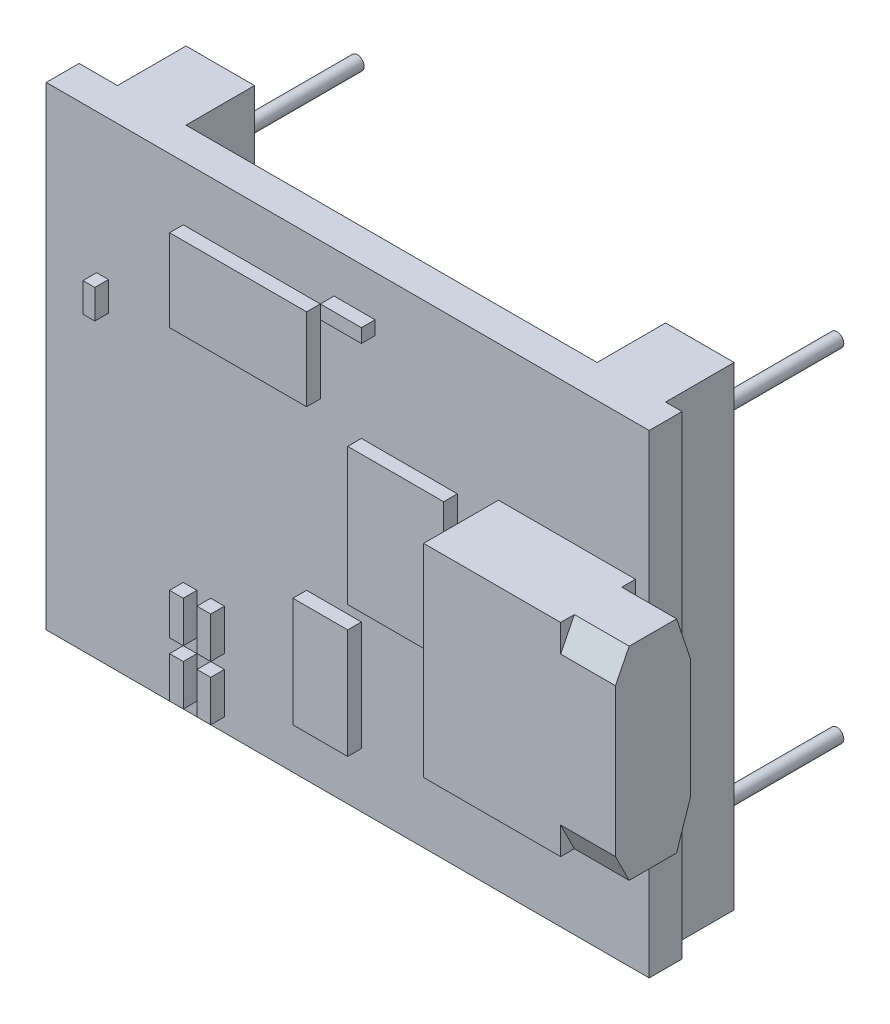
from build123d import *

# Parameters (mm, degrees)
ESQUISSE1_W             = 22
ESQUISSE1_H             = 17.3
BOSS_EXTRU_1_DEPTH      = 1.2
ESQUISSE2_W             = 5.5
ESQUISSE2_H             = 7.4
ESQUISSE2_W_2           = 1.5
BOSS_EXTRU_2_DEPTH      = 2.73
ESQUISSE5_W             = 2
ESQUISSE5_H             = 4
ESQUISSE5_W_2           = 0.5
ESQUISSE5_H_2           = 1.5
ESQUISSE5_W_3           = 5
ESQUISSE5_H_3           = 3
ESQUISSE5_W_4           = 1.5
ESQUISSE5_H_4           = 0.5
ESQUISSE5_W_5           = 0.43407564
ESQUISSE5_H_5           = 1.061073785
ESQUISSE5_W_6           = 3.5
ESQUISSE5_H_6           = 5
BOSS_EXTRU_5_DEPTH      = 0.5
ENL_V_MAT_EXTRU_4_DEPTH = 2
ESQUISSE11_W            = 2.5
ESQUISSE11_H            = 17.3
BOSS_EXTRU_8_DEPTH      = 2.5
ESQUISSE12_R            = 0.25
BOSS_EXTRU_9_DEPTH      = 5


with BuildPart() as part:
    # Esquisse1 → Boss.-Extru.1 (new body)
    with BuildSketch(Plane.XY):
        with Locations((-11, 8.65)):
            Rectangle(ESQUISSE1_W, ESQUISSE1_H)
    extrude(amount=BOSS_EXTRU_1_DEPTH)

    # Esquisse2 → Boss.-Extru.2 (add)
    with BuildSketch(Plane.XY.offset(1.2)):
        with Locations((-2.75, 8.65)):
            Rectangle(ESQUISSE2_W, ESQUISSE2_H)
        with Locations((0.75, 8.65)):
            Rectangle(ESQUISSE2_W_2, ESQUISSE2_H)
    extrude(amount=BOSS_EXTRU_2_DEPTH)

    # Esquisse5 → Boss.-Extru.5 (add)
    with BuildSketch(Plane.XY.offset(1.2)):
        with Locations((-11.5, 4)):
            Rectangle(ESQUISSE5_W, ESQUISSE5_H)
        with Locations((-15.75, 1.25)):
            Rectangle(ESQUISSE5_W_2, ESQUISSE5_H_2)
        with Locations((-16.75, 1.25)):
            Rectangle(ESQUISSE5_W_2, ESQUISSE5_H_2)
        with Locations((-15.75, 3.25)):
            Rectangle(ESQUISSE5_W_2, ESQUISSE5_H_2)
        with Locations((-16.75, 3.25)):
            Rectangle(ESQUISSE5_W_2, ESQUISSE5_H_2)
        with Locations((-14.5, 13.8)):
            Rectangle(ESQUISSE5_W_3, ESQUISSE5_H_3)
        with Locations((-10.75, 15.55)):
            Rectangle(ESQUISSE5_W_4, ESQUISSE5_H_4)
        with Locations((-19.944355947, 11.67647182)):
            Rectangle(ESQUISSE5_W_5, ESQUISSE5_H_5)
        with Locations((-8.75, 9.3)):
            Rectangle(ESQUISSE5_W_6, ESQUISSE5_H_6)
    extrude(amount=BOSS_EXTRU_5_DEPTH)

    # Esquisse8 → Enlèv. mat.-Extru.4 (cut)
    with BuildSketch(Plane(origin=(1.5, 0, 0), x_dir=(0, 0, -1), z_dir=(1, 0, 0))):
        Polygon((-1.2, 6.45), (-1.2, 4.95), (-1.7, 4.95), align=None)
        Polygon((-1.2, 10.85), (-1.7, 12.35), (-1.2, 12.35), align=None)
        Polygon((-3.93, 4.95), (-3.93, 5.95), (-3.43, 4.95), align=None)
        Polygon((-3.93, 11.35), (-3.43, 12.35), (-3.93, 12.35), align=None)
    extrude(amount=-ENL_V_MAT_EXTRU_4_DEPTH, mode=Mode.SUBTRACT)

    # Esquisse11 → Boss.-Extru.8 (add)
    with BuildSketch(Plane(origin=(0, 0, 0), x_dir=(-1, 0, 0), z_dir=(0, 0, -1))):
        with Locations((1.85, 8.65)):
            Rectangle(ESQUISSE11_W, ESQUISSE11_H)
        with Locations((19.35, 8.65)):
            Rectangle(ESQUISSE11_W, ESQUISSE11_H)
    extrude(amount=BOSS_EXTRU_8_DEPTH)

    # Esquisse12 → Boss.-Extru.9 (add)
    with BuildSketch(Plane(origin=(0, 0, -2.5), x_dir=(-1, 0, 0), z_dir=(0, 0, -1))):
        with Locations(Location((1.85, 2.4, 0), (0, 0, 180))):
            Circle(ESQUISSE12_R)
        with Locations(Location((1.85, 14.9, 0), (0, 0, 180))):
            Circle(ESQUISSE12_R)
        with Locations(Location((19.35, 14.9, 0), (0, 0, 180))):
            Circle(ESQUISSE12_R)
        with Locations(Location((19.35, 2.4, 0), (0, 0, 180))):
            Circle(ESQUISSE12_R)
    extrude(amount=BOSS_EXTRU_9_DEPTH)


solid = part.part
